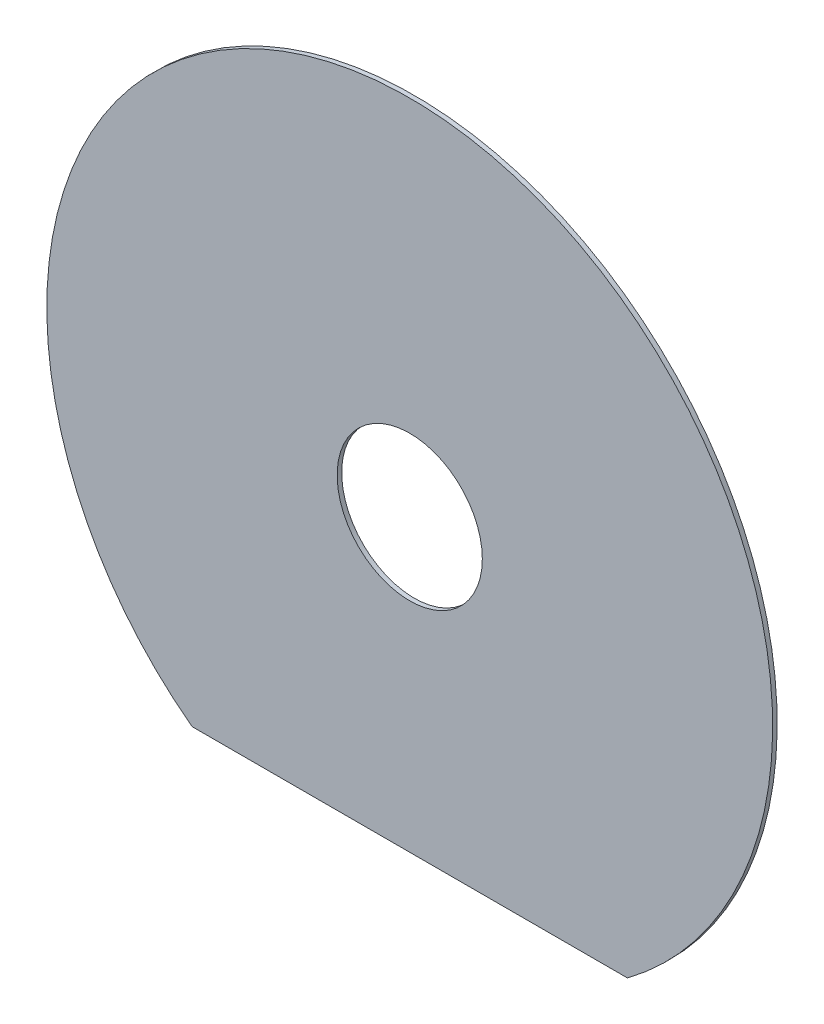
from build123d import *

# Parameters (mm, degrees)
SKETCH2_R           = 50.8
BOSS_EXTRUDE1_DEPTH = 3.175


with BuildPart() as part:
    # Sketch2 → Boss-Extrude1 (new body)
    with BuildSketch(Plane.XY):
        with BuildLine():
            Line((-152.4, -203.2), (152.4, -203.2))
            ThreePointArc((152.4, -203.2), (0, 254), (-152.4, -203.2))
        make_face()
        Circle(SKETCH2_R, mode=Mode.SUBTRACT)
    extrude(amount=BOSS_EXTRUDE1_DEPTH)


solid = part.part
